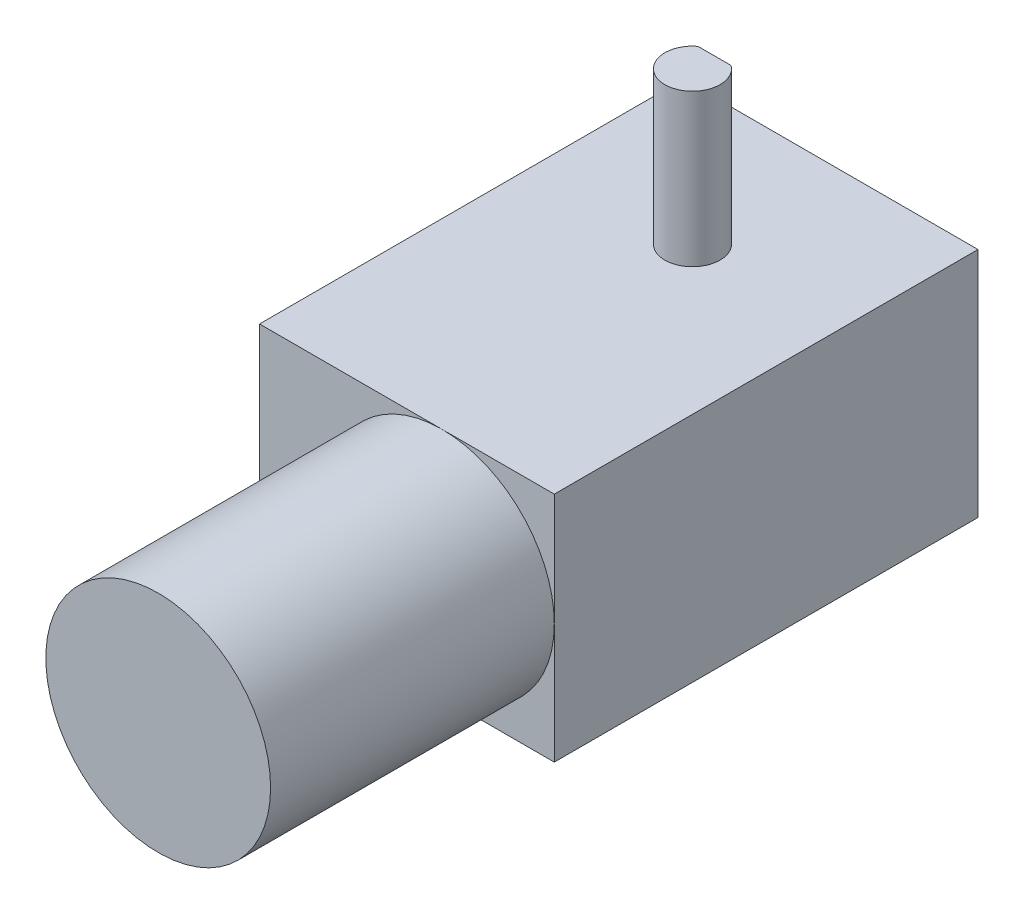
from build123d import *

# Parameters (mm, degrees)
SKETCH1_W           = 32
SKETCH1_H           = 46
BOSS_EXTRUDE1_DEPTH = 25.2
BOSS_EXTRUDE2_START = 25.2
BOSS_EXTRUDE2_DEPTH = 16.5
SKETCH2_R           = 12.2
BOSS_EXTRUDE3_DEPTH = 30.8


with BuildPart() as part:
    # Sketch1 → Boss-Extrude1 (new body)
    # profile 1 of 2: a face of its own
    with BuildSketch(Plane(origin=(0, 0, 0), x_dir=(1, 0, 0), z_dir=(0, 1, 0))):
        with Locations((0, -8)):
            Rectangle(SKETCH1_W, SKETCH1_H)
        with BuildLine():
            ThreePointArc((-1.8, 2.4), (0, -3), (1.8, 2.4))
            Line((1.8, 2.4), (-1.8, 2.4))
        make_face(mode=Mode.SUBTRACT)
    # profile 2 of 2: a face of its own
    with BuildSketch(Plane(origin=(0, 0, 0), x_dir=(1, 0, 0), z_dir=(0, 1, 0))):
        with BuildLine():
            Line((-1.8, 2.4), (1.8, 2.4))
            ThreePointArc((1.8, 2.4), (0, -3), (-1.8, 2.4))
        make_face()
    extrude(amount=BOSS_EXTRUDE1_DEPTH)

    # Sketch1<3> → Boss-Extrude2 (add)
    with BuildSketch(Plane(origin=(0, 0, 0), x_dir=(1, 0, 0), z_dir=(0, 1, 0)).offset(BOSS_EXTRUDE2_START)):
        with BuildLine():
            Line((-1.8, 2.4), (1.8, 2.4))
            ThreePointArc((1.8, 2.4), (0, -3), (-1.8, 2.4))
        make_face()
    extrude(amount=BOSS_EXTRUDE2_DEPTH)

    # Sketch2 → Boss-Extrude3 (add)
    with BuildSketch(Plane.XY.offset(31)):
        with Locations((3.8, 13)):
            Circle(SKETCH2_R)
    extrude(amount=BOSS_EXTRUDE3_DEPTH)


solid = part.part
